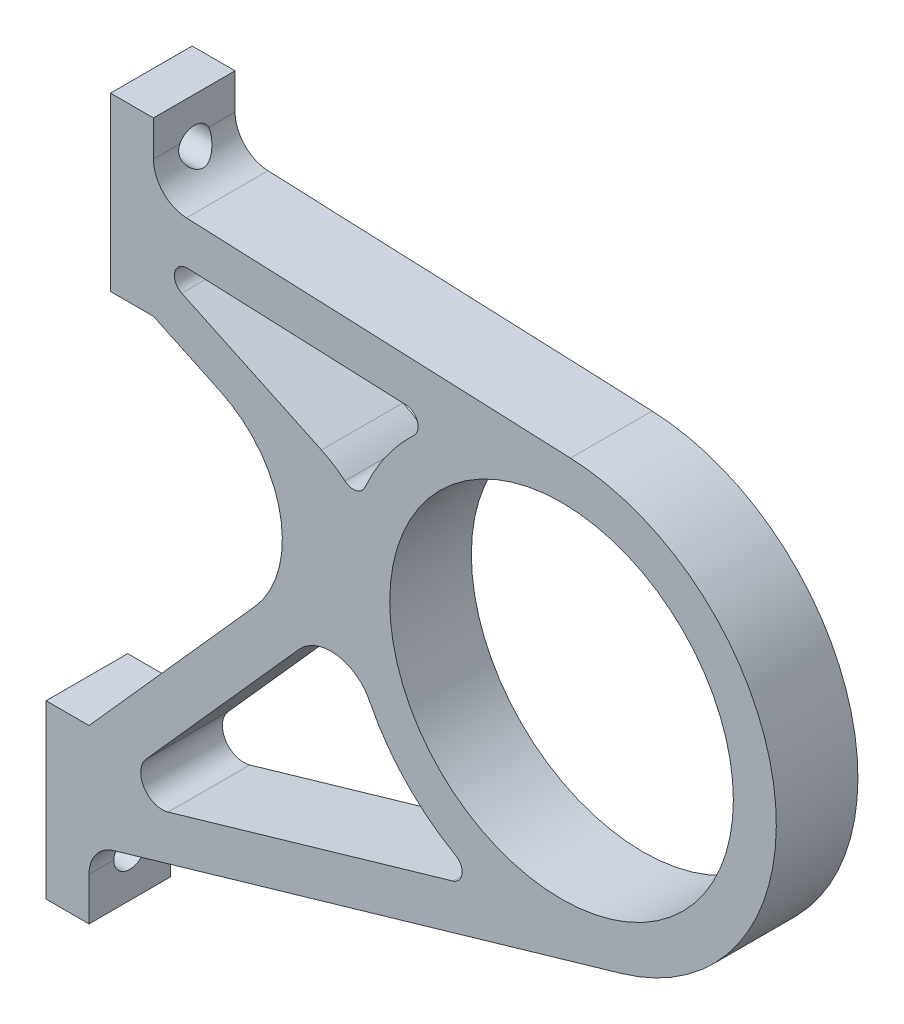
from build123d import *

# Parameters (mm, degrees)
SKETCH1_R           = 50.8
BOSS_EXTRUDE1_DEPTH = 24.13
FILLET1_R           = 10.16
SKETCH2_R           = 4.7625
CUT_EXTRUDE1_DEPTH  = 252.642736633


with BuildPart() as part:
    # Sketch1 → Boss-Extrude1 (new body)
    with BuildSketch(Plane.XY):
        with BuildLine():
            Line((-133.35, 88.9), (-133.35, 38.1))
            Line((-133.35, 38.1), (-120.65, 38.1))
            Line((-120.65, 38.1), (-100.755098441, 28.715816927))
            ThreePointArc((-100.755098441, 28.715816927), (-83.188973521, 6.337707108), (-90.601125221, -21.128791593))
            Line((-90.601125221, -21.128791593), (-139.7, -76.2))
            Line((-139.7, -76.2), (-152.4, -76.2))
            Line((-152.4, -76.2), (-152.4, -127))
            Line((-152.4, -127), (-139.7, -127))
            Line((-139.7, -127), (-139.7, -106.68))
            Line((-139.7, -106.68), (17.704429235, -60.981990665))
            ThreePointArc((17.704429235, -60.981990665), (63.039807772, 7.631031129), (2.642419241, 63.444996813))
            Line((2.642419241, 63.444996813), (-120.65, 68.58))
            Line((-120.65, 68.58), (-120.65, 88.9))
            Line((-120.65, 88.9), (-133.35, 88.9))
        make_face()
        with Locations(Location((0, 0, 0), (0, 0, 180))):
            Circle(SKETCH1_R, mode=Mode.SUBTRACT)
        with BuildLine():
            Line((-46.037431664, 52.76145265), (-110.49514893, 55.446050662))
            ThreePointArc((-110.49514893, 55.446050662), (-114.353417179, 52.549377789), (-112.279082271, 48.193452823))
            Line((-112.279082271, 48.193452823), (-70.985594525, 28.715816927))
            ThreePointArc((-70.985594525, 28.715816927), (-67.368742902, 26.71210826), (-64.042949916, 24.25536955))
            ThreePointArc((-64.042949916, 24.25536955), (-60.727043781, 23.453741785), (-58.09853243, 25.628314996))
            ThreePointArc((-58.09853243, 25.628314996), (-51.868282156, 36.632380569), (-43.581110206, 46.183729096))
            ThreePointArc((-43.581110206, 46.183729096), (-42.626724096, 50.287620053), (-46.037431664, 52.76145265))
        make_face(mode=Mode.SUBTRACT)
        with BuildLine():
            Line((-77.6210071, -25.653934719), (-122.808045193, -76.337474888))
            ThreePointArc((-122.808045193, -76.337474888), (-123.43951378, -83.950303149), (-116.297827314, -86.661432273))
            Line((-116.297827314, -86.661432273), (-32.118533433, -62.222309585))
            ThreePointArc((-32.118533433, -62.222309585), (-29.396609186, -59.006115837), (-31.302640742, -55.248481269))
            ThreePointArc((-31.302640742, -55.248481269), (-46.04089289, -43.731981225), (-56.784547657, -28.421209464))
            ThreePointArc((-56.784547657, -28.421209464), (-66.469460728, -21.515994345), (-77.6210071, -25.653934719))
        make_face(mode=Mode.SUBTRACT)
    extrude(amount=BOSS_EXTRUDE1_DEPTH)

    # Fillet1
    fillet1_edges = [part.edges().sort_by_distance(p)[0] for p in [
        (-120.65, 68.58, 12.065),
        (-139.7, -106.68, 12.065),
    ]]
    fillet(fillet1_edges, radius=FILLET1_R)

    # Sketch2 → Cut-Extrude1 (cut, through all)
    with BuildSketch(Plane.ZY.offset(152.4)):
        with Locations(Location((12.065, -114.3, 0), (0, 0, 270))):
            Circle(SKETCH2_R)
        with Locations(Location((12.065, 76.2, 0), (0, 0, 180))):
            Circle(SKETCH2_R)
    extrude(amount=-CUT_EXTRUDE1_DEPTH, mode=Mode.SUBTRACT)


solid = part.part
